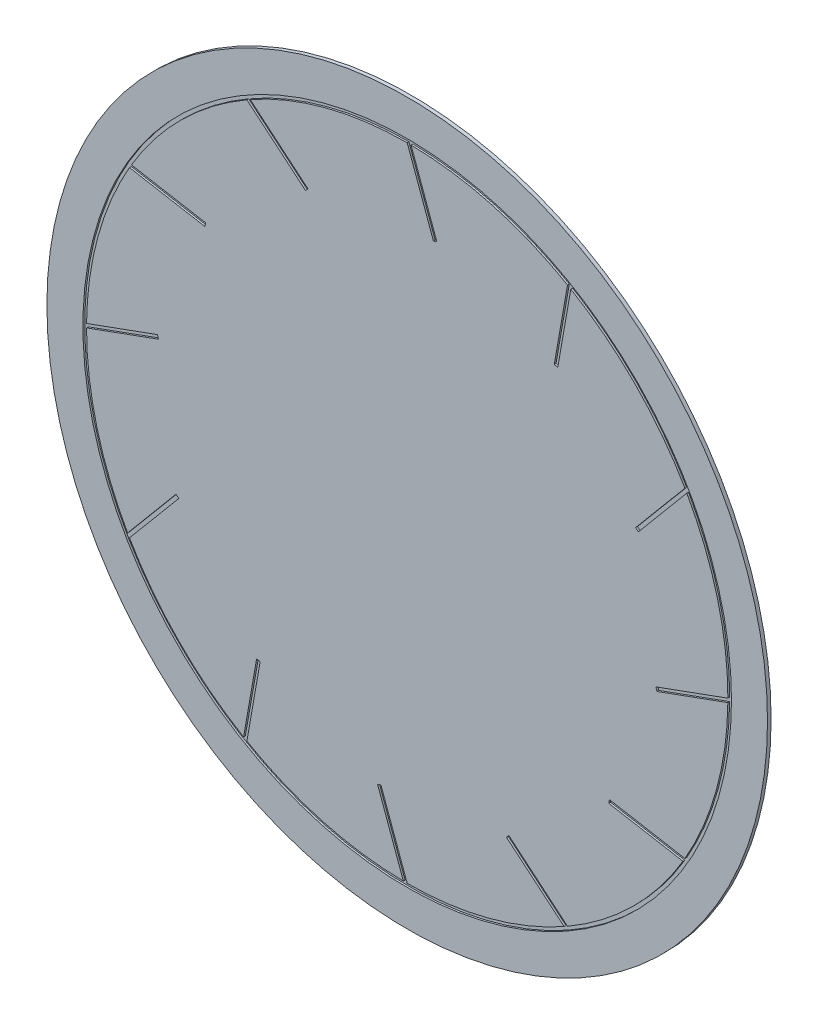
from build123d import *

# Parameters (mm, degrees)
SKETCH1_R           = 254
BOSS_EXTRUDE1_DEPTH = 2.54
SKETCH2_R           = 228.6
SKETCH2_R_2         = 226.06
CUT_EXTRUDE1_DEPTH  = 1.27
CUT_EXTRUDE2_DEPTH  = 1.27


with BuildPart() as part:
    # Sketch1 → Boss-Extrude1 (new body)
    with BuildSketch(Plane.XY):
        Circle(SKETCH1_R)
    extrude(amount=BOSS_EXTRUDE1_DEPTH)

    # Sketch2 → Cut-Extrude1 (cut)
    with BuildSketch(Plane.XY.offset(2.54)):
        Circle(SKETCH2_R)
        Circle(SKETCH2_R_2, mode=Mode.SUBTRACT)
    extrude(amount=-CUT_EXTRUDE1_DEPTH, mode=Mode.SUBTRACT)

    # Sketch4 → Cut-Extrude2 (cut)
    with BuildSketch(Plane.XY.offset(2.54)):
        with BuildLine():
            Line((-226.06, 0), (-175.26, 18.489687901))
            Line((-175.26, 18.489687901), (-176.128731164, 20.876507158))
            Line((-176.128731164, 20.876507158), (-226.043768674, 2.708919262))
            ThreePointArc((-226.043768674, 2.708919262), (-226.055942132, 1.354483944), (-226.06, 0))
        make_face()
        with BuildLine():
            Line((-195.77370278, 113.03), (-142.534768317, 103.64253943))
            Line((-142.534768317, 103.64253943), (-142.093701946, 106.143951123))
            Line((-142.093701946, 106.143951123), (-194.405186408, 115.367877234))
            ThreePointArc((-194.405186408, 115.367877234), (-195.092946591, 114.200988571), (-195.77370278, 113.03))
        make_face()
        with BuildLine():
            Line((-113.03, 195.77370278), (-71.61746057, 161.024456218))
            Line((-71.61746057, 161.024456218), (-69.984780041, 162.970209103))
            Line((-69.984780041, 162.970209103), (-110.67589144, 197.11410567))
            ThreePointArc((-110.67589144, 197.11410567), (-111.854953561, 196.447430535), (-113.03, 195.77370278))
        make_face()
        with BuildLine():
            Line((0, 226.06), (18.489687901, 175.26))
            Line((18.489687901, 175.26), (20.876507158, 176.128731164))
            Line((20.876507158, 176.128731164), (2.708919262, 226.043768674))
            ThreePointArc((2.708919262, 226.043768674), (1.354483944, 226.055942132), (0, 226.06))
        make_face()
        with BuildLine():
            Line((113.03, 195.77370278), (103.64253943, 142.534768317))
            Line((103.64253943, 142.534768317), (106.143951123, 142.093701946))
            Line((106.143951123, 142.093701946), (115.367877234, 194.405186408))
            ThreePointArc((115.367877234, 194.405186408), (114.200988571, 195.092946591), (113.03, 195.77370278))
        make_face()
        with BuildLine():
            Line((195.77370278, 113.03), (161.024456218, 71.61746057))
            Line((161.024456218, 71.61746057), (162.970209103, 69.984780041))
            Line((162.970209103, 69.984780041), (197.11410567, 110.67589144))
            ThreePointArc((197.11410567, 110.67589144), (196.447430535, 111.854953561), (195.77370278, 113.03))
        make_face()
        with BuildLine():
            Line((226.06, 0), (175.26, -18.489687901))
            Line((175.26, -18.489687901), (176.128731164, -20.876507158))
            Line((176.128731164, -20.876507158), (226.043768674, -2.708919262))
            ThreePointArc((226.043768674, -2.708919262), (226.055942132, -1.354483944), (226.06, 0))
        make_face()
        with BuildLine():
            Line((195.77370278, -113.03), (142.534768317, -103.64253943))
            Line((142.534768317, -103.64253943), (142.093701946, -106.143951123))
            Line((142.093701946, -106.143951123), (194.405186408, -115.367877234))
            ThreePointArc((194.405186408, -115.367877234), (195.092946591, -114.200988571), (195.77370278, -113.03))
        make_face()
        with BuildLine():
            Line((113.03, -195.77370278), (71.61746057, -161.024456218))
            Line((71.61746057, -161.024456218), (69.984780041, -162.970209103))
            Line((69.984780041, -162.970209103), (110.67589144, -197.11410567))
            ThreePointArc((110.67589144, -197.11410567), (111.854953561, -196.447430535), (113.03, -195.77370278))
        make_face()
        with BuildLine():
            Line((0, -226.06), (-18.489687901, -175.26))
            Line((-18.489687901, -175.26), (-20.876507158, -176.128731164))
            Line((-20.876507158, -176.128731164), (-2.708919262, -226.043768674))
            ThreePointArc((-2.708919262, -226.043768674), (-1.354483944, -226.055942132), (0, -226.06))
        make_face()
        with BuildLine():
            Line((-113.03, -195.77370278), (-103.64253943, -142.534768317))
            Line((-103.64253943, -142.534768317), (-106.143951123, -142.093701946))
            Line((-106.143951123, -142.093701946), (-115.367877234, -194.405186408))
            ThreePointArc((-115.367877234, -194.405186408), (-114.200988571, -195.092946591), (-113.03, -195.77370278))
        make_face()
        with BuildLine():
            Line((-195.77370278, -113.03), (-161.024456218, -71.61746057))
            Line((-161.024456218, -71.61746057), (-162.970209103, -69.984780041))
            Line((-162.970209103, -69.984780041), (-197.11410567, -110.67589144))
            ThreePointArc((-197.11410567, -110.67589144), (-196.447430535, -111.854953561), (-195.77370278, -113.03))
        make_face()
    extrude(amount=-CUT_EXTRUDE2_DEPTH, mode=Mode.SUBTRACT)


solid = part.part
